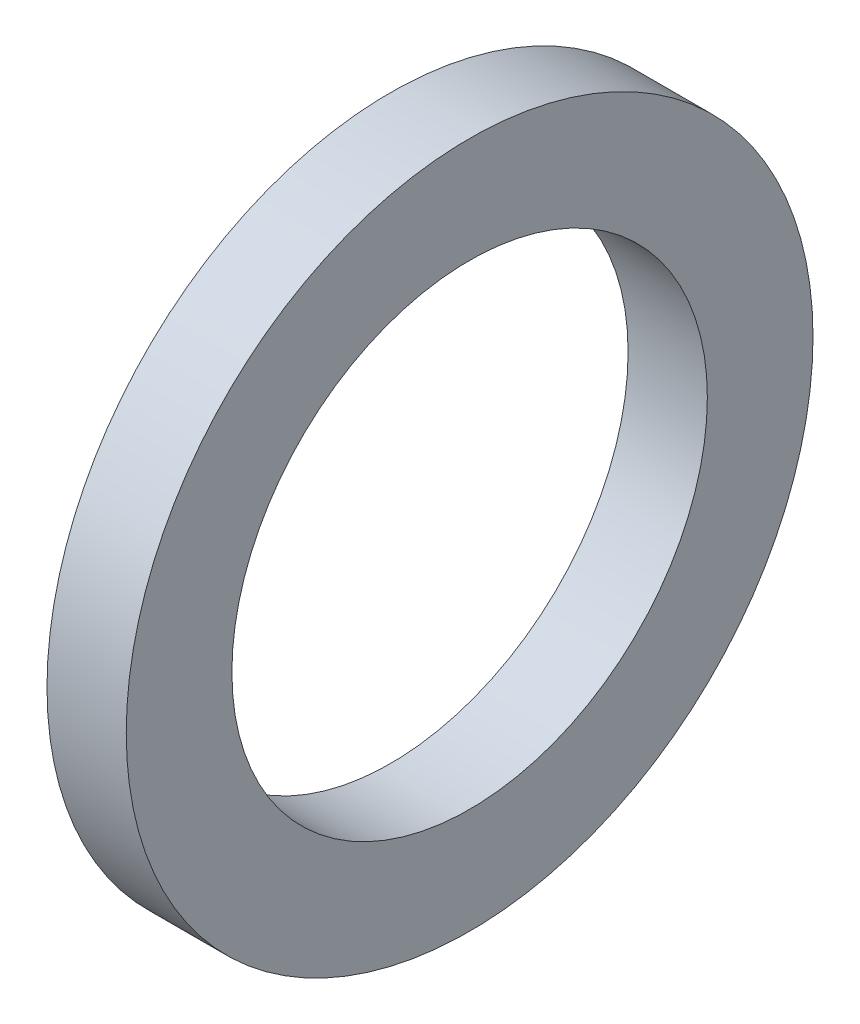
from build123d import *

# Parameters (mm, degrees)
SKETCH_1_R      = 65
SKETCH_1_R_2    = 45
EXTRUDE_1_DEPTH = 15


with BuildPart() as part:
    # 草图1 → 凸台-拉伸1 (new body)
    with BuildSketch(Plane(origin=(0, 0, 0), x_dir=(0, 0, -1), z_dir=(1, 0, 0))):
        Circle(SKETCH_1_R)
        Circle(SKETCH_1_R_2, mode=Mode.SUBTRACT)
    extrude(amount=EXTRUDE_1_DEPTH)


solid = part.part
